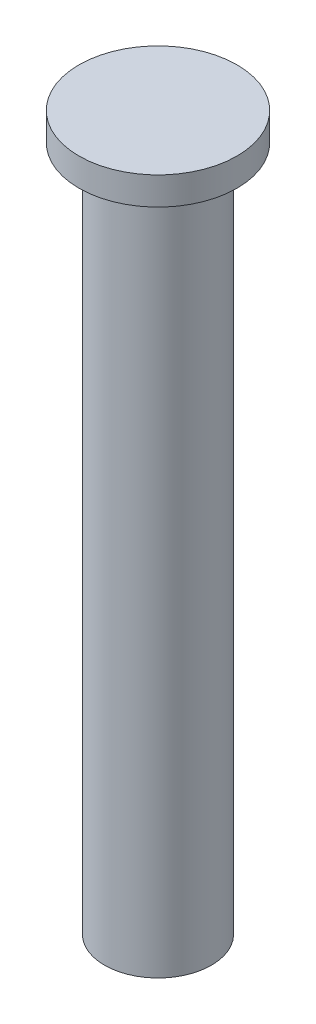
from build123d import *

# Parameters (mm, degrees)
SKETCH1_R           = 2.3
SKETCH1_R_2         = 1.8
BOSS_EXTRUDE1_DEPTH = 29.5
SKETCH2_R           = 3.4
BOSS_EXTRUDE2_DEPTH = 1.2


with BuildPart() as part:
    # Sketch1 → Boss-Extrude1 (new body)
    with BuildSketch(Plane(origin=(0, 0, 0), x_dir=(1, 0, 0), z_dir=(0, 1, 0))):
        with Locations(Location((0, 0, 0), (0, 0, 270))):
            Circle(SKETCH1_R)
        with Locations(Location((0, 0, 0), (0, 0, 270))):
            Circle(SKETCH1_R_2, mode=Mode.SUBTRACT)
    extrude(amount=BOSS_EXTRUDE1_DEPTH)

    # Sketch2 → Boss-Extrude2 (add)
    with BuildSketch(Plane(origin=(0, 29.5, 0), x_dir=(1, 0, 0), z_dir=(0, 1, 0))):
        with Locations(Location((0, 0, 0), (0, 0, 270))):
            Circle(SKETCH2_R)
    extrude(amount=BOSS_EXTRUDE2_DEPTH)


solid = part.part
